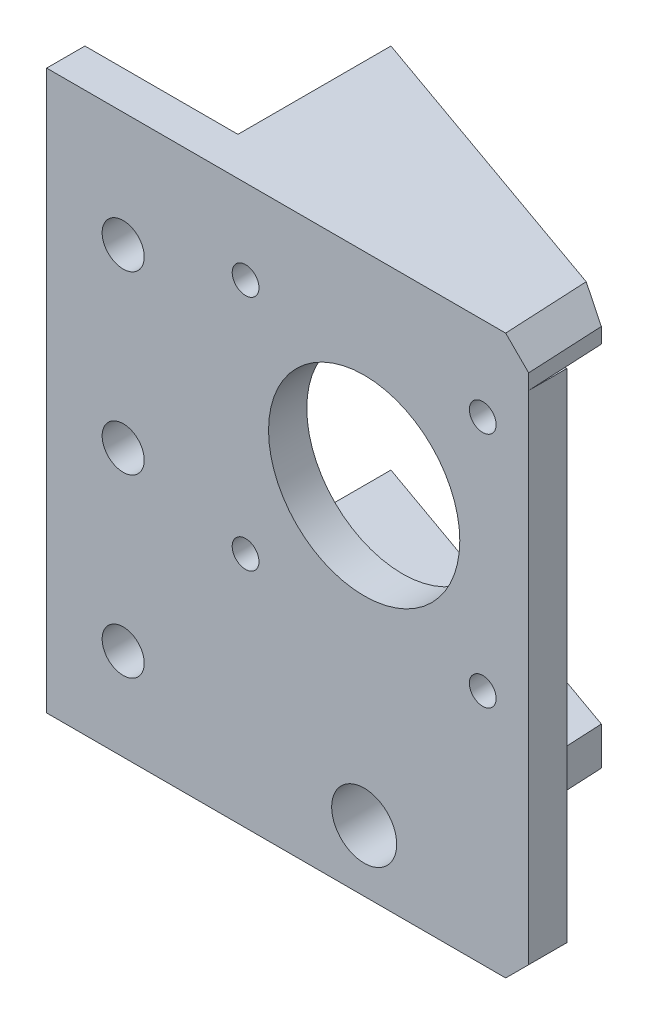
from build123d import *

# Parameters (mm, degrees)
SKETCH_2_W          = 63
SKETCH_2_H          = 43
SKETCH_2_R          = 1.75
SKETCH_2_R_2        = 12.5
SKETCH_2_R_3        = 2.75
EXTRUDE_1_DEPTH     = 5
SKETCH_3_W          = 63
SKETCH_3_H          = 5
EXTRUDE_2_DEPTH     = 25
SKETCH_4_R          = 4.25
CUT_EXTRUDE_2_DEPTH = 25
SKETCH_5_R          = 7.75
SKETCH_5_R_2        = 4.25
EXTRUDE_3_DEPTH     = 10
EXTRUDE_4_DEPTH     = 5
EXTRUDE_5_DEPTH     = 5
SKETCH_10_R         = 2.75
CUT_EXTRUDE_3_DEPTH = 75.939521233
SKETCH_11_W         = 20
SKETCH_11_H         = 5
EXTRUDE_6_DEPTH     = 5
CHAMFER_1_SIZE      = 3


with BuildPart() as part:
    # 草图2 → 凸台-拉伸1 (new body)
    with BuildSketch(Plane.XY):
        with Locations((11.527972028, -9.531468531)):
            Rectangle(SKETCH_2_W, SKETCH_2_H)
        with Locations((-13.972027972, 5.968531469)):
            Circle(SKETCH_2_R, mode=Mode.SUBTRACT)
        with Locations((17.027972028, 5.968531469)):
            Circle(SKETCH_2_R, mode=Mode.SUBTRACT)
        with Locations((17.027972028, -25.031468531)):
            Circle(SKETCH_2_R, mode=Mode.SUBTRACT)
        with Locations((-13.972027972, -25.031468531)):
            Circle(SKETCH_2_R, mode=Mode.SUBTRACT)
        with Locations((1.527972028, -9.531468531)):
            Circle(SKETCH_2_R_2, mode=Mode.SUBTRACT)
        with Locations((33.027972028, 1.968531469)):
            Circle(SKETCH_2_R_3, mode=Mode.SUBTRACT)
        with Locations((33.027972028, -21.031468531)):
            Circle(SKETCH_2_R_3, mode=Mode.SUBTRACT)
    extrude(amount=EXTRUDE_1_DEPTH)

    # 草图3 → 凸台-拉伸2 (add)
    with BuildSketch(Plane.XZ.offset(31.031468531)):
        with Locations((11.527972028, 2.5)):
            Rectangle(SKETCH_3_W, SKETCH_3_H)
    extrude(amount=EXTRUDE_2_DEPTH)

    # 草图4 → 切除-拉伸2 (cut)
    with BuildSketch(Plane.XY.offset(5)):
        with Locations((1.527972028, -48.031468531)):
            Circle(SKETCH_4_R)
    extrude(amount=-CUT_EXTRUDE_2_DEPTH, mode=Mode.SUBTRACT)

    # 草图5 → 凸台-拉伸3 (add)
    with BuildSketch(Plane(origin=(0, 0, 0), x_dir=(-1, 0, 0), z_dir=(0, 0, -1))):
        with Locations(Location((-1.527972028, -48.031468531, 0), (0, 0, 180))):
            Circle(SKETCH_5_R)
        with Locations(Location((-1.527972028, -48.031468531, 0), (0, 0, 180))):
            Circle(SKETCH_5_R_2, mode=Mode.SUBTRACT)
    extrude(amount=EXTRUDE_3_DEPTH)

    # 草图7 → 凸台-拉伸4 (add)
    with BuildSketch(Plane(origin=(0, 11.968531469, 0), x_dir=(1, 0, 0), z_dir=(0, 1, 0))):
        Polygon((-19.972027972, -5), (-19.472027972, 5), (23.027972028, 20), (23.027972028, -5), align=None)
    extrude(amount=EXTRUDE_4_DEPTH)

    # 草图8 → 凸台-拉伸5 (add)
    with BuildSketch(Plane(origin=(0, -31.031468531, 0), x_dir=(-1, 0, 0), z_dir=(0, -1, 0))):
        Polygon((-23.027972028, 20), (-23.027972028, 0), (19.722027972, 0), (19.472027972, 5), align=None)
    extrude(amount=EXTRUDE_5_DEPTH)

    # 草图10 → 切除-拉伸3 (cut, through all)
    with BuildSketch(Plane.XY.offset(5)):
        with Locations((33.027972028, -44.031468531)):
            Circle(SKETCH_10_R)
    extrude(amount=-CUT_EXTRUDE_3_DEPTH, mode=Mode.SUBTRACT)

    # 草图11 → 凸台-拉伸6 (add)
    with BuildSketch(Plane(origin=(0, 11.968531469, 0), x_dir=(1, 0, 0), z_dir=(0, 1, 0))):
        with Locations((33.027972028, -2.5)):
            Rectangle(SKETCH_11_W, SKETCH_11_H)
    extrude(amount=EXTRUDE_6_DEPTH)

    # 倒角1
    chamfer_1_edges = [part.edges().sort_by_distance(p)[0] for p in [
        (-19.972027972, -56.031468531, 2.5),
        (-19.722027972, 16.968531469, 0),
    ]]
    chamfer(chamfer_1_edges, length=CHAMFER_1_SIZE)


with BuildPart() as body_2:
    # 镜向2: mirrored copy
    add(part.part.mirror(Plane(origin=(43.027972028, 11.968531469, 5), x_dir=(0, 0, 1), z_dir=(-1, 0, 0))))


solid = body_2.part
